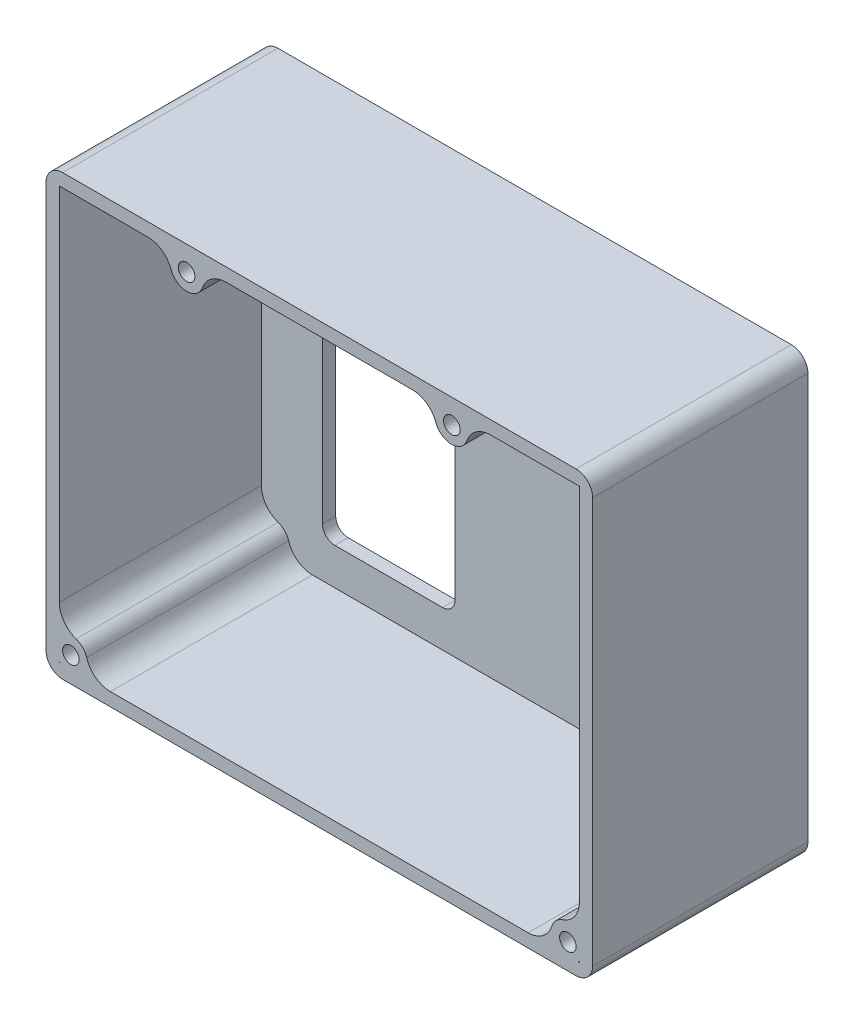
from build123d import *

# Parameters (mm, degrees)
SKETCH1_W           = 66
SKETCH1_H           = 53
BOSS_EXTRUDE1_DEPTH = 26
SHELL1_T            = -1.6
FILLET1_R           = 2
SKETCH2_R           = 2.5
SKETCH2_W           = 16
SKETCH2_H           = 28
CUT_EXTRUDE1_DEPTH  = 5
SKETCH3_R           = 2
BOSS_EXTRUDE2_DEPTH = 24.4
FILLET2_R           = 3
FILLET3_R           = 1.5
SKETCH4_R           = 1
CUT_EXTRUDE2_DEPTH  = 515.754449712


with BuildPart() as part:
    # Sketch1 → Boss-Extrude1 (new body)
    with BuildSketch(Plane.XY.offset(40)):
        with Locations((106.004254286, 468.448442556)):
            Rectangle(SKETCH1_W, SKETCH1_H)
    extrude(amount=BOSS_EXTRUDE1_DEPTH)

    # Shell1
    shell1_openings = [part.faces().sort_by_distance(p)[0] for p in [
        (106.004254286, 468.448442556, 66),
    ]]
    offset(amount=SHELL1_T, openings=shell1_openings, kind=Kind.INTERSECTION)

    # Fillet1
    fillet1_edges = [part.edges().sort_by_distance(p)[0] for p in [
        (73.004254286, 494.948442556, 53),
        (139.004254286, 494.948442556, 53),
        (139.004254286, 441.948442556, 53),
        (73.004254286, 441.948442556, 53),
    ]]
    fillet(fillet1_edges, radius=FILLET1_R)

    # Sketch2 → Cut-Extrude1 (cut)
    with BuildSketch(Plane.XY.offset(41.6)):
        with Locations((79.932206481, 485.091899203)):
            Circle(SKETCH2_R)
        with Locations((132.121487701, 485.091899203)):
            Circle(SKETCH2_R)
        with Locations((121.980911954, 461.997551837)):
            Rectangle(SKETCH2_W, SKETCH2_H)
        with Locations((89.980911954, 461.997551837)):
            Rectangle(SKETCH2_W, SKETCH2_H)
    extrude(amount=-CUT_EXTRUDE1_DEPTH, mode=Mode.SUBTRACT)

    # Sketch3 → Boss-Extrude2 (add)
    with BuildSketch(Plane.XY.offset(41.6)):
        with Locations((89.997613128, 492.01389561)):
            Circle(SKETCH3_R)
        with Locations((121.954957607, 492.01389561)):
            Circle(SKETCH3_R)
        with Locations((75.98529147, 445.090629457)):
            Circle(SKETCH3_R)
        with Locations((135.997102491, 445.090629457)):
            Circle(SKETCH3_R)
    extrude(amount=BOSS_EXTRUDE2_DEPTH)

    # Fillet2
    fillet2_edges = [part.edges().sort_by_distance(p)[0] for p in [
        (88.507987521, 493.348442556, 53.8),
        (91.487238734, 493.348442556, 53.8),
        (120.465332, 493.348442556, 53.8),
        (123.444583213, 493.348442556, 53.8),
        (134.723658514, 443.548442556, 53.8),
        (137.404254286, 446.5118697, 53.8),
        (77.258735447, 443.548442556, 53.8),
        (74.604254286, 446.537258746, 53.8),
    ]]
    fillet(fillet2_edges, radius=FILLET2_R)

    # Fillet3
    fillet3_edges = [part.edges().sort_by_distance(p)[0] for p in [
        (81.980911954, 447.997551837, 40.8),
        (81.980911954, 475.997551837, 40.8),
        (97.980911954, 475.997551837, 40.8),
        (97.980911954, 447.997551837, 40.8),
        (113.980911954, 475.997551837, 40.8),
        (129.980911954, 475.997551837, 40.8),
        (129.980911954, 447.997551837, 40.8),
        (113.980911954, 447.997551837, 40.8),
    ]]
    fillet(fillet3_edges, radius=FILLET3_R)

    # Sketch4 → Cut-Extrude2 (cut, through all)
    with BuildSketch(Plane.XY.offset(66)):
        with Locations((89.975104107, 492.043680815)):
            Circle(SKETCH4_R)
        with Locations((122.005633098, 492.043680815)):
            Circle(SKETCH4_R)
        with Locations((75.994176926, 444.994296882)):
            Circle(SKETCH4_R)
        with Locations((136.02065658, 444.994296882)):
            Circle(SKETCH4_R)
    extrude(amount=-CUT_EXTRUDE2_DEPTH, mode=Mode.SUBTRACT)


solid = part.part
